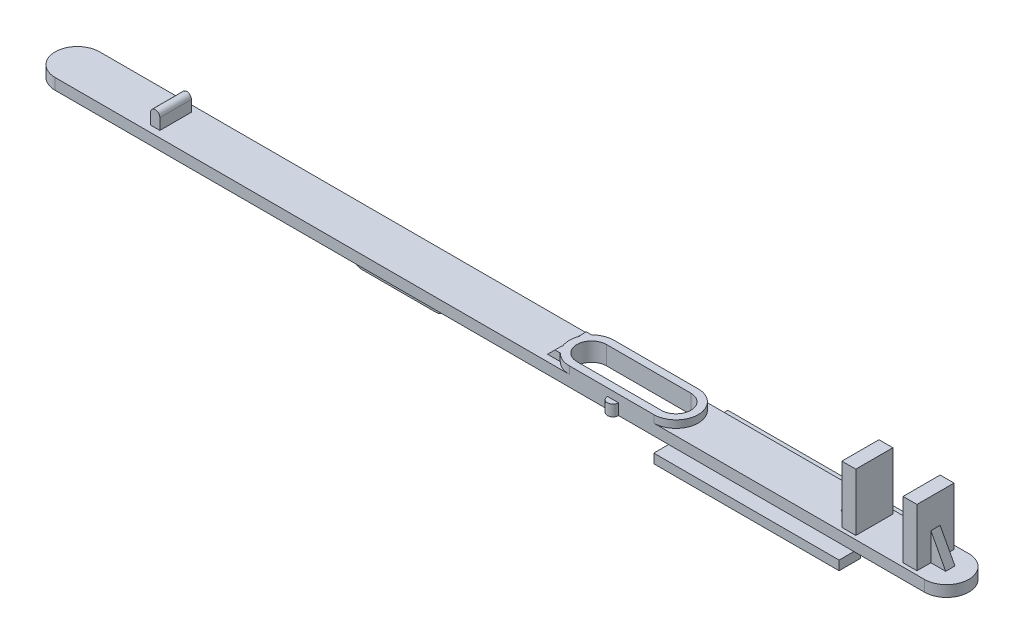
from build123d import *

# Parameters (mm, degrees)
BOSS_EXTRUDE1_DEPTH  = 1.2
BOSS_EXTRUDE2_DEPTH  = 0.8
SKETCH3_W            = 20
SKETCH3_H            = 2.3
BOSS_EXTRUDE3_DEPTH  = 1
SKETCH4_W            = 20
SKETCH4_H            = 2.3
BOSS_EXTRUDE4_DEPTH  = 1
CUT_EXTRUDE1_START   = -0.8
CUT_EXTRUDE1_DEPTH   = 0.8
CUT_EXTRUDE2_START   = -0.8
CUT_EXTRUDE2_DEPTH   = 0.8
CUT_EXTRUDE3_DEPTH   = 50.502424183
BOSS_EXTRUDE5_DEPTH  = 1.2
BOSS_EXTRUDE6_DEPTH  = 1.2
SKETCH10_W           = 1.5
SKETCH10_H           = 4
BOSS_EXTRUDE7_DEPTH  = 6.2
SKETCH11_W           = 1.5
SKETCH11_H           = 4
BOSS_EXTRUDE8_DEPTH  = 6.2
BOSS_EXTRUDE9_DEPTH  = 3.4
BOSS_EXTRUDE10_DEPTH = 1
BOSS_EXTRUDE11_DEPTH = 1
DRAFT1_ANGLE         = 45
SKETCH15_W           = 0.9
SKETCH15_H           = 0.4
SKETCH16_W           = 0.9
SKETCH16_H           = 0.4
SKETCH17_W           = 0.9
SKETCH17_H           = 0.4
RIB1_REACH           = 52.012
SKETCH18_WALL_W      = 105.424996876
SKETCH18_WALL_H      = 1
RIB2_REACH           = 52.012
SKETCH19_WALL_W      = 105.424996876
SKETCH19_WALL_H      = 1
FILLET2_R            = 0.1


with BuildPart() as part:
    # Sketch1 → Boss-Extrude1 (new body)
    with BuildSketch(Plane.XZ):
        with BuildLine():
            Line((46.9, 2.4), (-46.9, 2.4))
            ThreePointArc((-46.9, 2.4), (-49.3, 0), (-46.9, -2.4))
            Line((-46.9, -2.4), (46.9, -2.4))
            ThreePointArc((46.9, -2.4), (49.3, 0), (46.9, 2.4))
        make_face()
    extrude(amount=-BOSS_EXTRUDE1_DEPTH)

    # Sketch2 → Boss-Extrude2 (add)
    with BuildSketch(Plane(origin=(0, 1.2, 0), x_dir=(-1, 0, 0), z_dir=(0, 1, 0))):
        with BuildLine():
            Line((-6.33, 2.4), (-6.33, 0.918))
            Line((-6.33, 0.918), (-6.382506821, 0.918))
            ThreePointArc((-6.382506821, 0.918), (-6.2, 0), (-6.382506821, -0.918))
            Line((-6.382506821, -0.918), (-6.33, -0.918))
            Line((-6.33, -0.918), (-6.33, -2.4))
            Line((-6.33, -2.4), (-17.7, -2.4))
            ThreePointArc((-17.7, -2.4), (-20.1, 0), (-17.7, 2.4))
            Line((-17.7, 2.4), (-6.33, 2.4))
        make_face()
    extrude(amount=BOSS_EXTRUDE2_DEPTH)

    # Sketch3 → Boss-Extrude3 (add)
    with BuildSketch(Plane.XZ):
        with Locations((29.3, 2.85)):
            Rectangle(SKETCH3_W, SKETCH3_H)
    extrude(amount=BOSS_EXTRUDE3_DEPTH)

    # Sketch4 → Boss-Extrude4 (add)
    with BuildSketch(Plane.XZ):
        with Locations((29.3, -2.85)):
            Rectangle(SKETCH4_W, SKETCH4_H)
    extrude(amount=BOSS_EXTRUDE4_DEPTH)

    # Sketch5 → Cut-Extrude1 (cut)
    with BuildSketch(Plane(origin=(0, 2, 0), x_dir=(-1, 0, 0), z_dir=(0, 1, 0)).offset(CUT_EXTRUDE1_START)):
        with BuildLine():
            Line((-8.6, -2.4), (-6.33, -2.4))
            Line((-6.33, -2.4), (-6.33, -1.697))
            Line((-6.33, -1.697), (-6.902887452, -1.697))
            ThreePointArc((-6.902887452, -1.697), (-7.681523, -2.21729565), (-8.6, -2.4))
        make_face()
    extrude(amount=CUT_EXTRUDE1_DEPTH, mode=Mode.SUBTRACT)

    # Sketch6 → Cut-Extrude2 (cut)
    with BuildSketch(Plane(origin=(0, 2, 0), x_dir=(-1, 0, 0), z_dir=(0, 1, 0)).offset(CUT_EXTRUDE2_START)):
        with BuildLine():
            Line((-6.902887452, 1.697), (-6.33, 1.697))
            Line((-6.33, 1.697), (-6.33, 2.4))
            Line((-6.33, 2.4), (-8.6, 2.4))
            ThreePointArc((-8.6, 2.4), (-7.681523, 2.21729565), (-6.902887452, 1.697))
        make_face()
    extrude(amount=CUT_EXTRUDE2_DEPTH, mode=Mode.SUBTRACT)

    # Sketch7 → Cut-Extrude3 (cut, through all)
    with BuildSketch(Plane.XZ):
        with BuildLine():
            Line((17.7, 1.6), (8.6, 1.6))
            ThreePointArc((8.6, 1.6), (7, 0), (8.6, -1.6))
            Line((8.6, -1.6), (17.7, -1.6))
            ThreePointArc((17.7, -1.6), (19.3, 0), (17.7, 1.6))
        make_face()
    extrude(amount=-CUT_EXTRUDE3_DEPTH, mode=Mode.SUBTRACT)

    # Sketch8 → Boss-Extrude5 (add)
    with BuildSketch(Plane.XZ):
        with BuildLine():
            Line((12.7, 2.4), (13.9, 2.4))
            ThreePointArc((13.9, 2.4), (13.3, 3), (12.7, 2.4))
        make_face()
    extrude(amount=-BOSS_EXTRUDE5_DEPTH)

    # Sketch9 → Boss-Extrude6 (add)
    with BuildSketch(Plane.XZ):
        with BuildLine():
            Line((13.9, -2.4), (12.7, -2.4))
            ThreePointArc((12.7, -2.4), (13.3, -3), (13.9, -2.4))
        make_face()
    extrude(amount=-BOSS_EXTRUDE6_DEPTH)

    # Sketch10 → Boss-Extrude7 (add)
    with BuildSketch(Plane(origin=(0, 1.2, 0), x_dir=(-1, 0, 0), z_dir=(0, 1, 0))):
        with Locations((-38.35, 0)):
            Rectangle(SKETCH10_W, SKETCH10_H)
    extrude(amount=BOSS_EXTRUDE7_DEPTH)

    # Sketch11 → Boss-Extrude8 (add)
    with BuildSketch(Plane(origin=(0, 1.2, 0), x_dir=(-1, 0, 0), z_dir=(0, 1, 0))):
        with Locations((-44.95, 0)):
            Rectangle(SKETCH11_W, SKETCH11_H)
    extrude(amount=BOSS_EXTRUDE8_DEPTH)

    # Sketch12 → Boss-Extrude9 (add)
    with BuildSketch(Plane(origin=(0, 0, -1.7), x_dir=(-1, 0, 0), z_dir=(0, 0, -1))):
        with BuildLine():
            Line((36.3, 1.2), (37.3, 1.2))
            Line((37.3, 1.2), (37.3, 2.4))
            ThreePointArc((37.3, 2.4), (36.8, 2.9), (36.3, 2.4))
            Line((36.3, 2.4), (36.3, 1.2))
        make_face()
    extrude(amount=-BOSS_EXTRUDE9_DEPTH)

    # Sketch13 → Boss-Extrude10 (add)
    with BuildSketch(Plane(origin=(0, 0, -1.6), x_dir=(-1, 0, 0), z_dir=(0, 0, -1))):
        with BuildLine():
            Line((46.5, 0), (36.5, 0))
            ThreePointArc((36.5, 0), (36.792893219, -0.707106781), (37.5, -1))
            Line((37.5, -1), (45.5, -1))
            ThreePointArc((45.5, -1), (46.207106781, -0.707106781), (46.5, 0))
        make_face()
    extrude(amount=-BOSS_EXTRUDE10_DEPTH)

    # Sketch14 → Boss-Extrude11 (add)
    with BuildSketch(Plane(origin=(0, 0, 0.6), x_dir=(-1, 0, 0), z_dir=(0, 0, -1))):
        with BuildLine():
            Line((15.6, 0), (5.6, 0))
            ThreePointArc((5.6, 0), (5.892893219, -0.707106781), (6.6, -1))
            Line((6.6, -1), (14.6, -1))
            ThreePointArc((14.6, -1), (15.307106781, -0.707106781), (15.6, 0))
        make_face()
    extrude(amount=-BOSS_EXTRUDE11_DEPTH)

    # Draft1
    draft1_faces = [part.faces().sort_by_distance(p)[0] for p in [
        (6.33, 1.6, -1.3075),
        (6.33, 1.6, 1.3075),
    ]]
    draft(draft1_faces, Plane(origin=(8.6, 2, 0), x_dir=(1, 0, 0), z_dir=(0, 1, 0)), DRAFT1_ANGLE)

    # Sketch15 → Revolve1 (revolve)
    with BuildSketch(Plane(origin=(0, 0, 0), x_dir=(-1, 0, 0), z_dir=(0, 0, -1)), mode=Mode.PRIVATE) as revolve1_sk:
        with Locations((25.6, -0.2)):
            Rectangle(SKETCH15_W, SKETCH15_H)
    revolve(revolve1_sk.sketch.rotate(Axis((-26.05, -0.4, 0), (0, 1, 0)), 270), axis=Axis((-26.05, -0.4, 0), (0, 1, 0)))

    # Sketch16 → Revolve2 (revolve)
    with BuildSketch(Plane(origin=(0, 0, 0), x_dir=(-1, 0, 0), z_dir=(0, 0, -1)), mode=Mode.PRIVATE) as revolve2_sk:
        with Locations((33.6, -0.2)):
            Rectangle(SKETCH16_W, SKETCH16_H)
    revolve(revolve2_sk.sketch.rotate(Axis((-34.05, -0.4, 0), (0, 1, 0)), 270), axis=Axis((-34.05, -0.4, 0), (0, 1, 0)))

    # Sketch17 → Revolve3 (revolve)
    with BuildSketch(Plane(origin=(0, 0, 0), x_dir=(-1, 0, 0), z_dir=(0, 0, -1)), mode=Mode.PRIVATE) as revolve3_sk:
        with Locations((17.6, -0.2)):
            Rectangle(SKETCH17_W, SKETCH17_H)
    revolve(revolve3_sk.sketch.rotate(Axis((-18.05, -0.4, 0), (0, 1, 0)), 270), axis=Axis((-18.05, -0.4, 0), (0, 1, 0)))

    # Sketch18 wall → Rib1 (add, up to next)
    with BuildSketch(Plane(origin=(46.5, 2.7, 0), x_dir=(0.470588235294, -0.882352941176, 0), z_dir=(-0.882352941176, -0.470588235294, 0)), mode=Mode.PRIVATE) as rib1_sk1:
        Rectangle(SKETCH18_WALL_W, SKETCH18_WALL_H)
    rib1_tool1 = extrude(rib1_sk1.sketch, amount=RIB1_REACH, mode=Mode.PRIVATE) - part.part
    add(rib1_tool1.solids().sort_by_distance((46.5, 2.7, 0))[0])

    # Sketch19 wall → Rib2 (add, up to next)
    with BuildSketch(Plane(origin=(36.8, 2.7, 0), x_dir=(-0.470588235294, -0.882352941176, 0), z_dir=(0.882352941176, -0.470588235294, 0)), mode=Mode.PRIVATE) as rib2_sk1:
        Rectangle(SKETCH19_WALL_W, SKETCH19_WALL_H)
    rib2_tool1 = extrude(rib2_sk1.sketch, amount=RIB2_REACH, mode=Mode.PRIVATE) - part.part
    add(rib2_tool1.solids().sort_by_distance((36.8, 2.7, 0))[0])

    # Fillet2
    fillet2_edges = [part.edges().sort_by_distance(p)[0] for p in [
        (13.3, 1.2, -3),
    ]]
    fillet(fillet2_edges, radius=FILLET2_R)


solid = part.part
